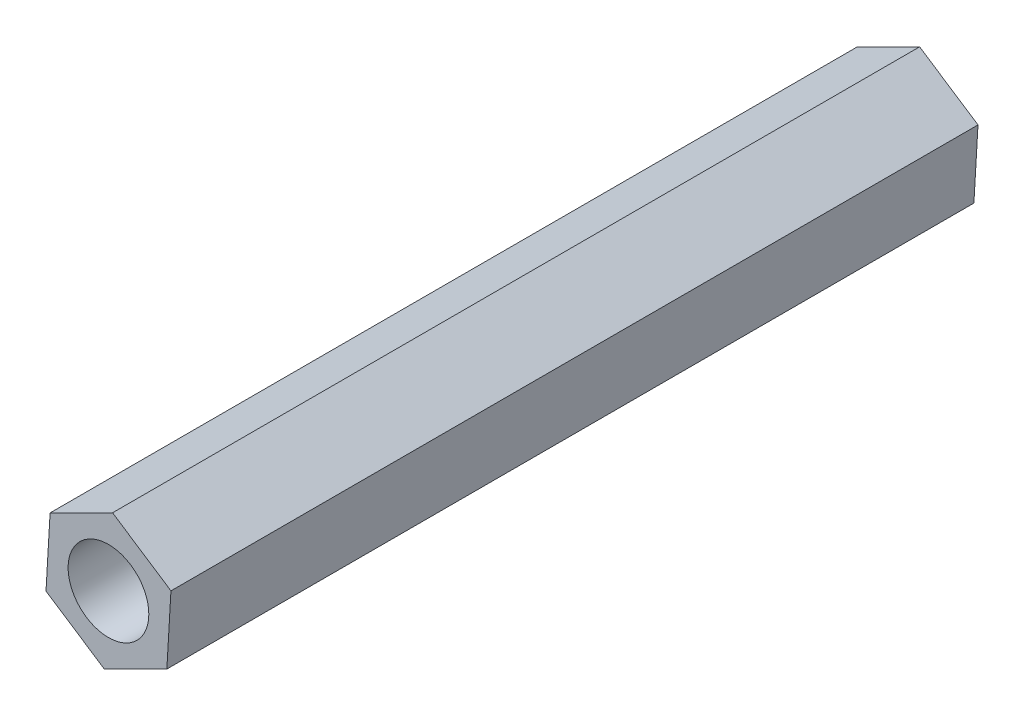
from build123d import *

# Parameters (mm, degrees)
SKETCH_1_R      = 2
EXTRUDE_1_DEPTH = 40


with BuildPart() as part:
    # 草图1 → 凸台-拉伸1 (new body)
    with BuildSketch(Plane.XY):
        Polygon((3.096430629, 1.553099275), (0.203191888, 3.458137224), (-2.893238741, 1.905037949), (-3.096430629, -1.553099275), (-0.203191888, -3.458137224), (2.893238741, -1.905037949), align=None)
        Circle(SKETCH_1_R, mode=Mode.SUBTRACT)
    extrude(amount=EXTRUDE_1_DEPTH)


solid = part.part
